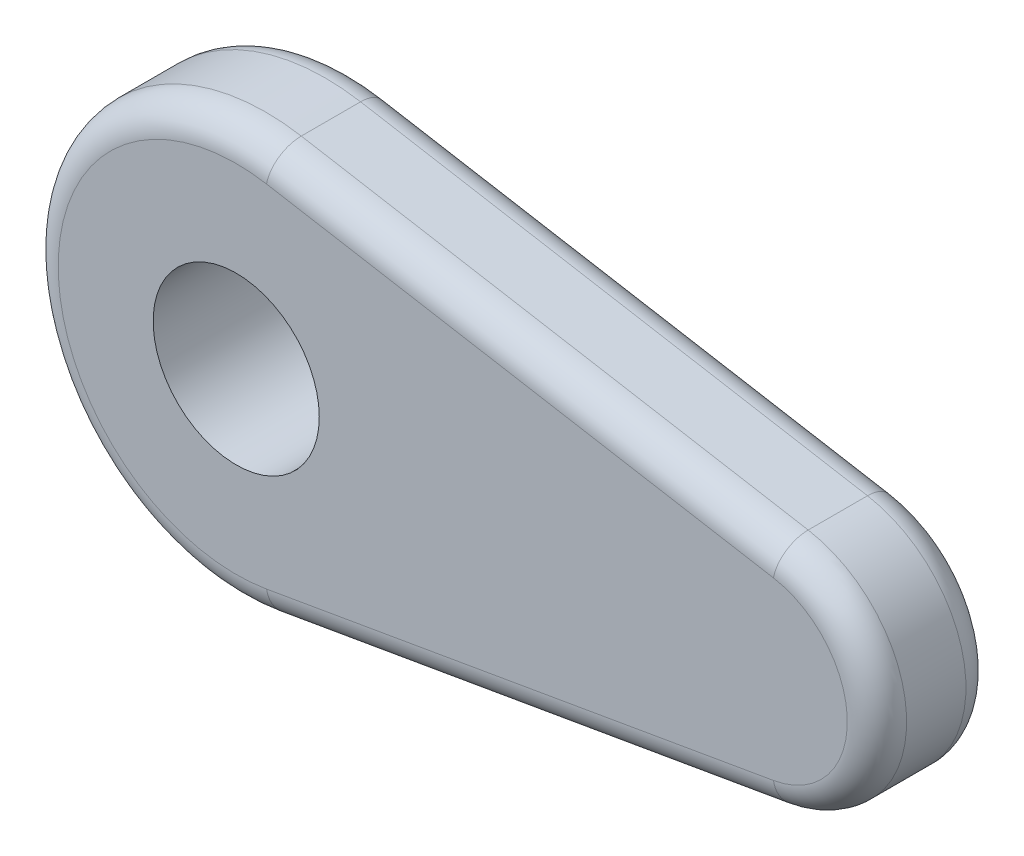
from build123d import *

# Parameters (mm, degrees)
SKETCH_1_R      = 14
EXTRUDE_1_DEPTH = 20
FILLET_1_R      = 5
FILLET_2_R      = 5


with BuildPart() as part:
    # 草图1 → 凸台-拉伸1 (new body)
    with BuildSketch(Plane.XY):
        with BuildLine():
            Line((-32.661153615, 34.487793909), (52.782028203, 19.707310805))
            ThreePointArc((52.782028203, 19.707310805), (69.372937294, 0), (52.782028203, -19.707310805))
            Line((52.782028203, -19.707310805), (-32.661153615, -34.487793909))
            ThreePointArc((-32.661153615, -34.487793909), (-73.627062706, 0), (-32.661153615, 34.487793909))
        make_face()
        with Locations((-38.627062706, 0)):
            Circle(SKETCH_1_R, mode=Mode.SUBTRACT)
    extrude(amount=EXTRUDE_1_DEPTH)

    # 圆角1
    fillet_1_edges = [part.edges().sort_by_distance(p)[0] for p in [
        (-73.627062706, 0, 20),
        (10.060437294, -27.097552357, 20),
        (69.372937294, 0, 20),
        (10.060437294, 27.097552357, 20),
    ]]
    fillet(fillet_1_edges, radius=FILLET_1_R)

    # 圆角2
    fillet_2_edges = [part.edges().sort_by_distance(p)[0] for p in [
        (10.060437294, -27.097552357, 0),
        (-73.627062706, 0, 0),
        (10.060437294, 27.097552357, 0),
        (69.372937294, 0, 0),
    ]]
    fillet(fillet_2_edges, radius=FILLET_2_R)


solid = part.part
